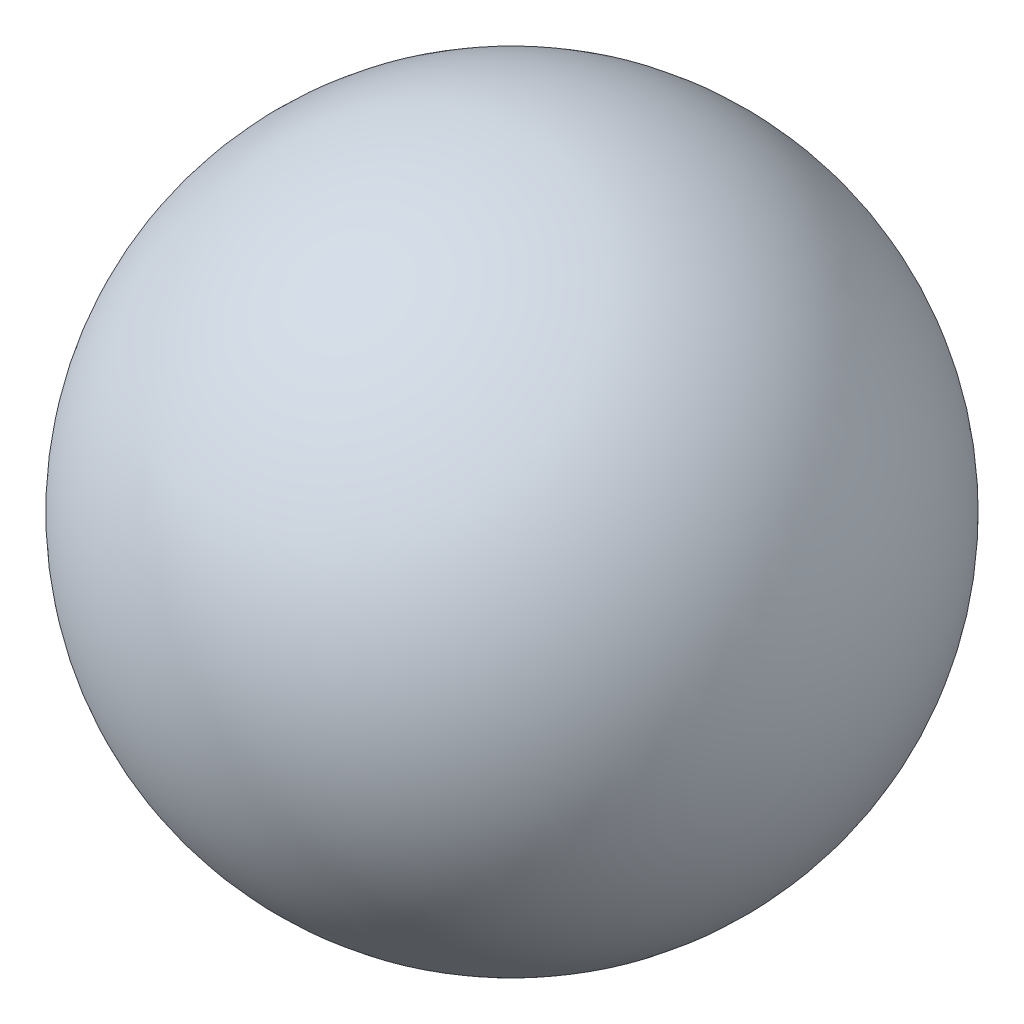
from build123d import *


with BuildPart() as part:
    # Sketch1 → Revolve1 (revolve)
    with BuildSketch(Plane.XY):
        with BuildLine():
            Line((0, 0), (0, 82.55))
            ThreePointArc((0, 82.55), (-41.275, 41.275), (0, 0))
        make_face()
    revolve(axis=Axis((0, 0, 0), (0, 1, 0)))


solid = part.part
